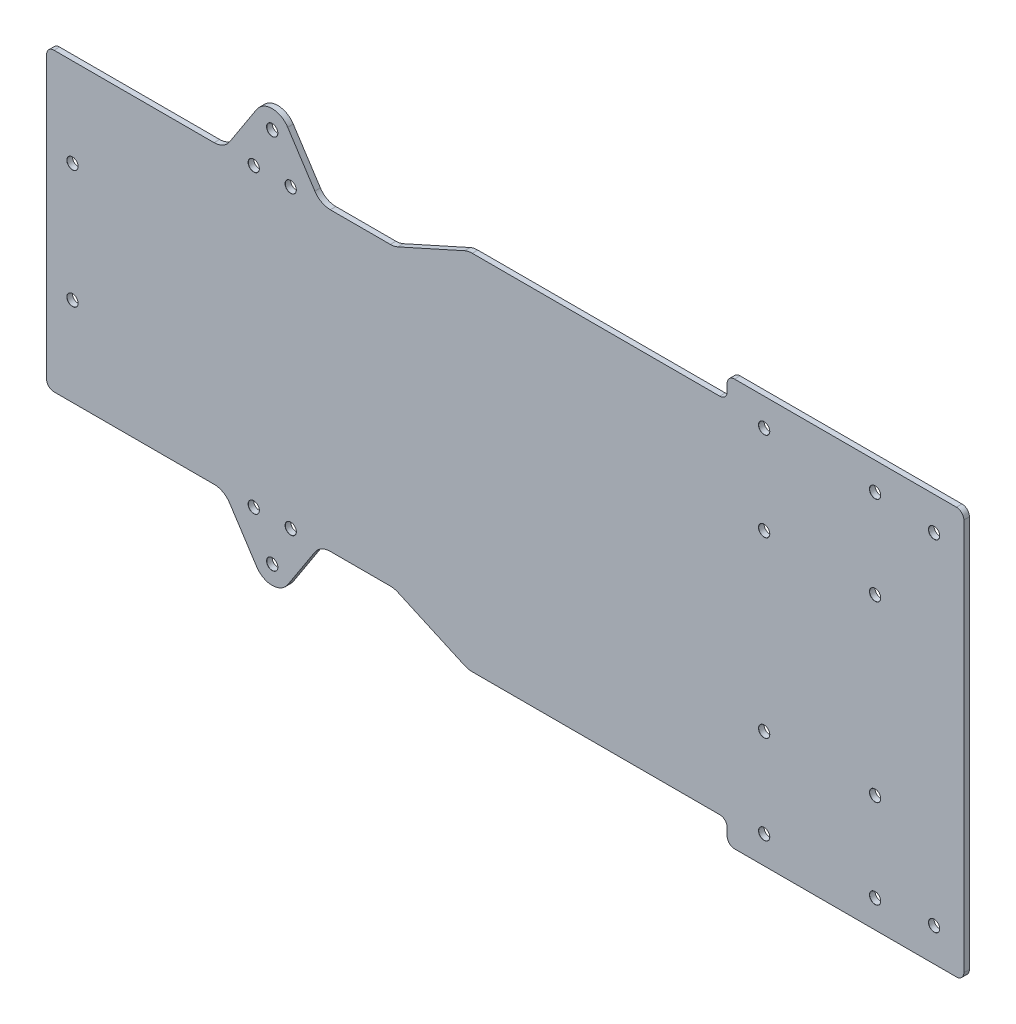
from build123d import *

# Parameters (mm, degrees)
BOSS_EXTRUDE2_DEPTH                = 1.5
F_3_0_3_DIAMETER_HOLE2_D           = 3
F_3_0_3_DIAMETER_HOLE2_DEPTH       = 4
F_3_0_3_DIAMETER_HOLE2_CSINK_D     = 3.05
F_3_0_3_DIAMETER_HOLE2_CSINK_ANGLE = 90
F_3_0_3_DIAMETER_HOLE2_TIP         = 0.901290929
F_3_0_3_DIAMETER_HOLE3_D           = 3
F_3_0_3_DIAMETER_HOLE3_DEPTH       = 4
F_3_0_3_DIAMETER_HOLE3_CSINK_D     = 3.05
F_3_0_3_DIAMETER_HOLE3_CSINK_ANGLE = 90
F_3_0_3_DIAMETER_HOLE3_TIP         = 0.901290929
F_3_0_3_DIAMETER_HOLE4_D           = 3
F_3_0_3_DIAMETER_HOLE4_DEPTH       = 4
F_3_0_3_DIAMETER_HOLE4_CSINK_D     = 3.05
F_3_0_3_DIAMETER_HOLE4_CSINK_ANGLE = 90
F_3_0_3_DIAMETER_HOLE4_TIP         = 0.901290929


with BuildPart() as part:
    # Sketch1 → Boss-Extrude2 (new body)
    with BuildSketch(Plane.XY):
        with BuildLine():
            Line((0, 0), (-124, 0))
            Line((-124, 0), (-124, -38))
            ThreePointArc((-124, -38), (-123.414213562, -39.414213562), (-122, -40))
            Line((-122, -40), (-78.713430221, -40))
            ThreePointArc((-78.713430221, -40), (-76.328551688, -40.60541761), (-74.521212139, -42.275058247))
            Line((-74.521212139, -42.275058247), (-67.192218082, -53.550433721))
            ThreePointArc((-67.192218082, -53.550433721), (-63, -55.825491968), (-58.807781918, -53.550433721))
            Line((-58.807781918, -53.550433721), (-51.478787861, -42.275058247))
            ThreePointArc((-51.478787861, -42.275058247), (-49.671448312, -40.60541761), (-47.286569779, -40))
            Line((-47.286569779, -40), (-31.073173444, -40))
            ThreePointArc((-31.073173444, -40), (-30.023896938, -40.111337727), (-29.021350058, -40.440392474))
            Line((-29.021350058, -40.440392474), (-10.978649942, -48.559607526))
            ThreePointArc((-10.978649942, -48.559607526), (-9.976103062, -48.888662273), (-8.926826556, -49))
            Line((-8.926826556, -49), (58, -49))
            ThreePointArc((58, -49), (59.414213562, -49.585786438), (60, -51))
            Line((60, -51), (60, -53))
            ThreePointArc((60, -53), (60.585786438, -54.414213562), (62, -55))
            Line((62, -55), (122, -55))
            ThreePointArc((122, -55), (123.414213562, -54.414213562), (124, -53))
            Line((124, -53), (124, 0))
            Line((124, 0), (0, 0))
        make_face()
    boss_extrude2 = extrude(amount=-BOSS_EXTRUDE2_DEPTH)

    # Mirror1: Boss-Extrude2 across plane
    add(boss_extrude2.mirror(Plane(origin=(0, 0, -1.5), x_dir=(0, 0, 1), z_dir=(0, 1, 0))))

    # Ø3.0 (3) Diameter Hole2
    with Locations(Plane.XY):
        with Locations((115.95, 46), (-117, 16), (115.95, -46), (-117, -16)):
            CounterSinkHole(F_3_0_3_DIAMETER_HOLE2_D / 2, F_3_0_3_DIAMETER_HOLE2_CSINK_D / 2, depth=F_3_0_3_DIAMETER_HOLE2_DEPTH, counter_sink_angle=F_3_0_3_DIAMETER_HOLE2_CSINK_ANGLE)
            with Locations((0, 0, -(F_3_0_3_DIAMETER_HOLE2_DEPTH + F_3_0_3_DIAMETER_HOLE2_TIP / 2))):  # 118° drill point
                Cone(0, F_3_0_3_DIAMETER_HOLE2_D / 2, F_3_0_3_DIAMETER_HOLE2_TIP, mode=Mode.SUBTRACT)

    # Ø3.0 (3) Diameter Hole3
    with Locations(Plane.XY):
        with Locations((-63, 50.825491968), (-68, 40), (-58, 40), (-58, -40), (-68, -40), (-63, -50.825491968)):
            CounterSinkHole(F_3_0_3_DIAMETER_HOLE3_D / 2, F_3_0_3_DIAMETER_HOLE3_CSINK_D / 2, depth=F_3_0_3_DIAMETER_HOLE3_DEPTH, counter_sink_angle=F_3_0_3_DIAMETER_HOLE3_CSINK_ANGLE)
            with Locations((0, 0, -(F_3_0_3_DIAMETER_HOLE3_DEPTH + F_3_0_3_DIAMETER_HOLE3_TIP / 2))):  # 118° drill point
                Cone(0, F_3_0_3_DIAMETER_HOLE3_D / 2, F_3_0_3_DIAMETER_HOLE3_TIP, mode=Mode.SUBTRACT)

    # Ø3.0 (3) Diameter Hole4
    with Locations(Plane.XY):
        with Locations((100, 47.5), (70, 47.5), (70, 23.5), (100, 23.5), (100, -47.5), (100, -23.5), (70, -23.5), (70, -47.5)):
            CounterSinkHole(F_3_0_3_DIAMETER_HOLE4_D / 2, F_3_0_3_DIAMETER_HOLE4_CSINK_D / 2, depth=F_3_0_3_DIAMETER_HOLE4_DEPTH, counter_sink_angle=F_3_0_3_DIAMETER_HOLE4_CSINK_ANGLE)
            with Locations((0, 0, -(F_3_0_3_DIAMETER_HOLE4_DEPTH + F_3_0_3_DIAMETER_HOLE4_TIP / 2))):  # 118° drill point
                Cone(0, F_3_0_3_DIAMETER_HOLE4_D / 2, F_3_0_3_DIAMETER_HOLE4_TIP, mode=Mode.SUBTRACT)


solid = part.part
